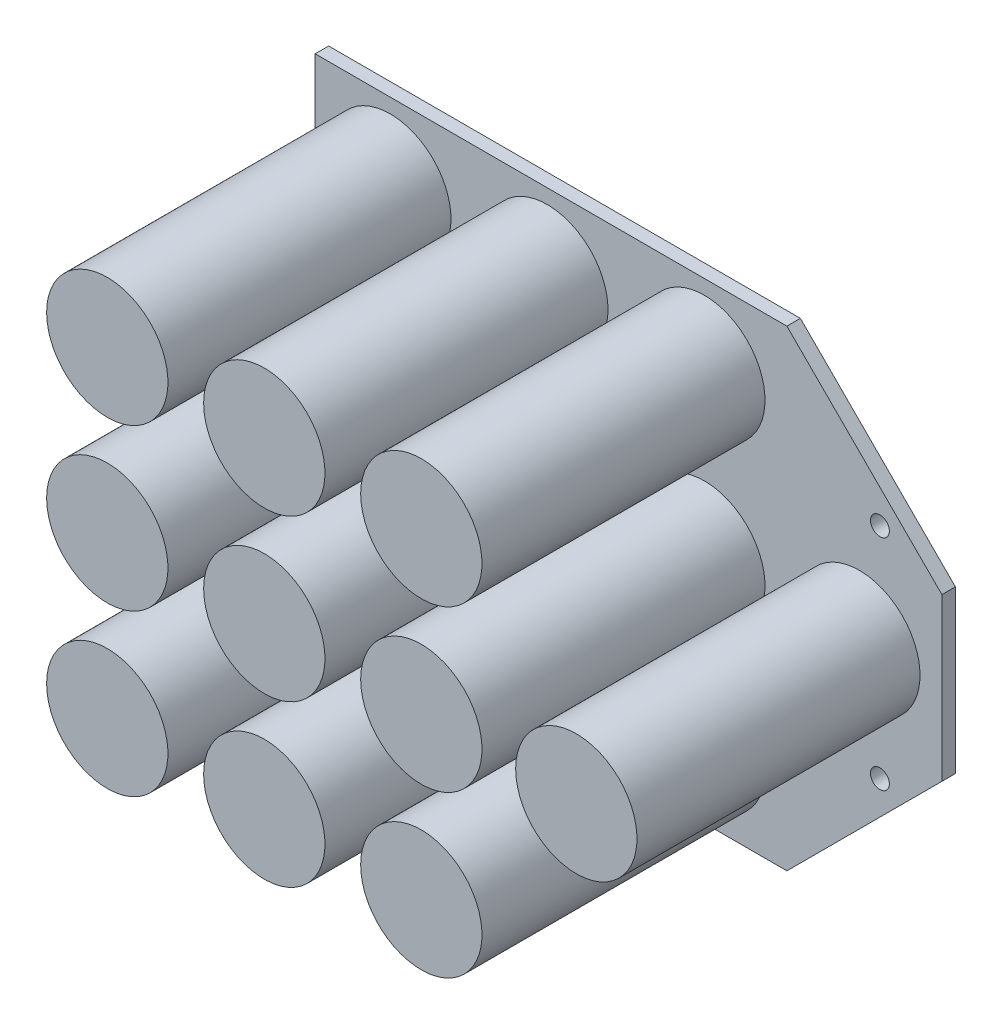
from build123d import *

# Parameters (mm, degrees)
EXTRUDE_1_DEPTH     = 2
SKETCH_3_R          = 1.4
CUT_EXTRUDE_1_DEPTH = 2
SKETCH_4_R          = 9
EXTRUDE_2_DEPTH     = 42


with BuildPart() as part:
    # 草图1 → 凸台-拉伸1 (new body)
    with BuildSketch(Plane.XY):
        Polygon((46.5, 12), (23.5, 35), (-46.5, 35), (-46.5, -35), (23.5, -35), (46.5, -12), align=None)
    extrude(amount=EXTRUDE_1_DEPTH)

    # 草图3 → 切除-拉伸1 (cut)
    with BuildSketch(Plane.XY.offset(2)):
        with Locations((-22.9, 16.25)):
            Circle(SKETCH_3_R)
        with Locations((37.3, 16.25)):
            Circle(SKETCH_3_R)
        with Locations(Location((37.3, -16.25, 0), (0, 0, 180))):
            Circle(SKETCH_3_R)
        with Locations(Location((-22.9, -16.25, 0), (0, 0, 180))):
            Circle(SKETCH_3_R)
    extrude(amount=-CUT_EXTRUDE_1_DEPTH, mode=Mode.SUBTRACT)

    # 草图4 → 凸台-拉伸2 (add)
    with BuildSketch(Plane.XY.offset(2)):
        with Locations(Location((-35.35, -23.85, 0), (0, 0, 180))):
            Circle(SKETCH_4_R)
        with Locations(Location((-12.05, -23.85, 0), (0, 0, 180))):
            Circle(SKETCH_4_R)
        with Locations(Location((11.25, -23.85, 0), (0, 0, 180))):
            Circle(SKETCH_4_R)
        with Locations(Location((-12.05, 0, 0), (0, 0, 180))):
            Circle(SKETCH_4_R)
        with Locations(Location((11.25, 0, 0), (0, 0, 180))):
            Circle(SKETCH_4_R)
        with Locations(Location((-12.05, 23.85, 0), (0, 0, 180))):
            Circle(SKETCH_4_R)
        with Locations(Location((11.25, 23.85, 0), (0, 0, 180))):
            Circle(SKETCH_4_R)
        with Locations(Location((-35.35, 0, 0), (0, 0, 180))):
            Circle(SKETCH_4_R)
        with Locations(Location((-35.35, 23.85, 0), (0, 0, 180))):
            Circle(SKETCH_4_R)
        with Locations(Location((34.25, 0, 0), (0, 0, 180))):
            Circle(SKETCH_4_R)
    extrude(amount=EXTRUDE_2_DEPTH)


solid = part.part
